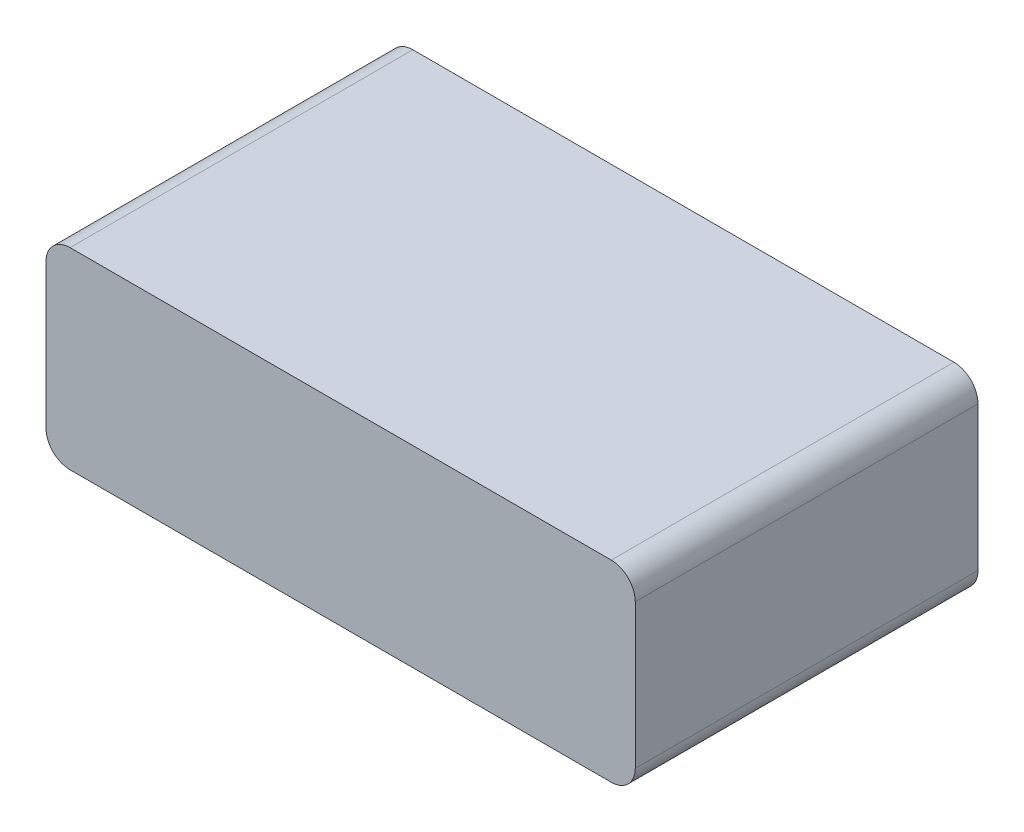
from build123d import *

# Parameters (mm, degrees)
SKETCH1_W           = 49
SKETCH1_H           = 28.5
BOSS_EXTRUDE1_DEPTH = 16
FILLET1_R           = 2


with BuildPart() as part:
    # Sketch1 → Boss-Extrude1 (new body)
    with BuildSketch(Plane(origin=(0, 0, 0), x_dir=(1, 0, 0), z_dir=(0, 1, 0))):
        with Locations((24.5, 14.25)):
            Rectangle(SKETCH1_W, SKETCH1_H)
    extrude(amount=BOSS_EXTRUDE1_DEPTH)

    # Fillet1
    fillet1_edges = [part.edges().sort_by_distance(p)[0] for p in [
        (49, 16, -14.25),
        (0, 16, -14.25),
        (49, 0, -14.25),
        (0, 0, -14.25),
    ]]
    fillet(fillet1_edges, radius=FILLET1_R)


solid = part.part
